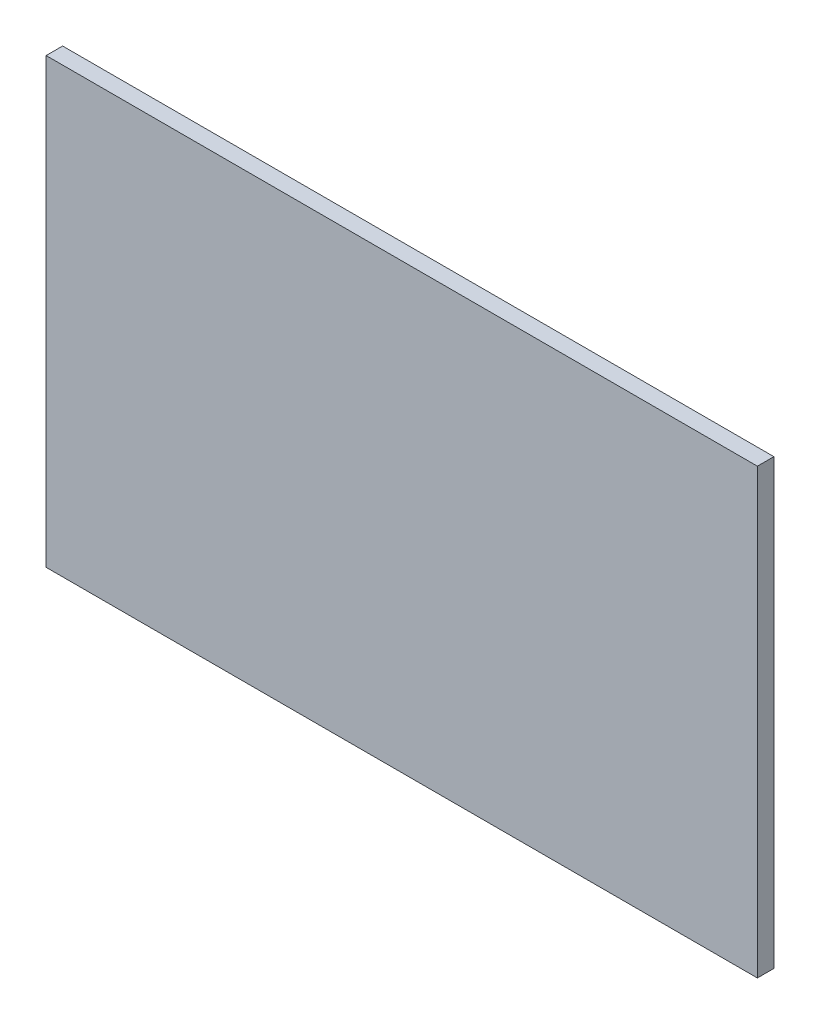
from build123d import *

# Parameters (mm, degrees)
SKETCH1_W           = 138
SKETCH1_H           = 86
BOSS_EXTRUDE1_DEPTH = 3.2


with BuildPart() as part:
    # Sketch1 → Boss-Extrude1 (new body)
    with BuildSketch(Plane.XY):
        Rectangle(SKETCH1_W, SKETCH1_H)
    extrude(amount=BOSS_EXTRUDE1_DEPTH)


solid = part.part
